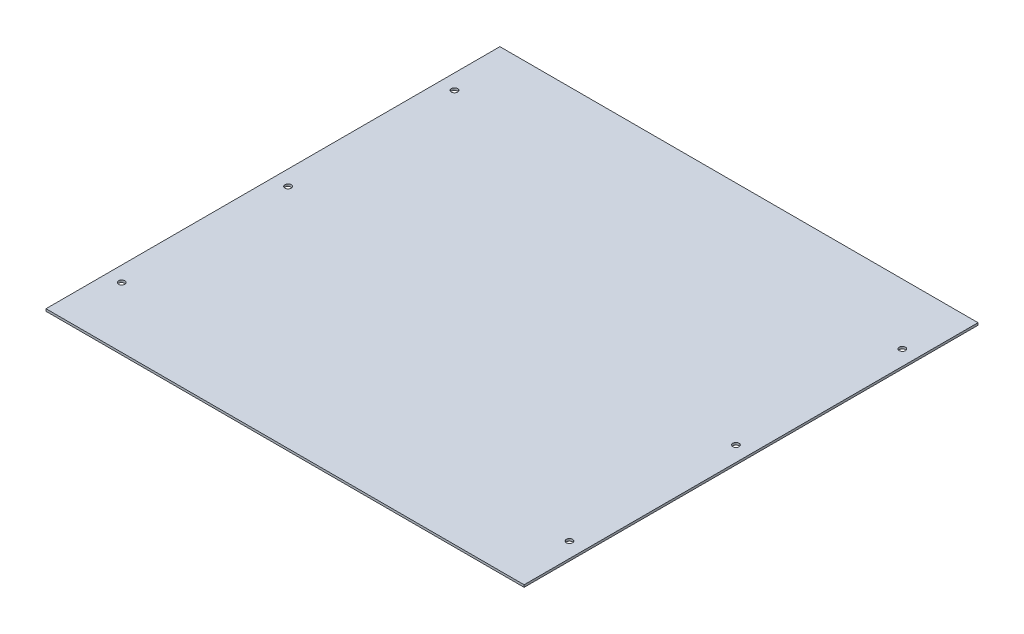
from build123d import *

# Parameters (mm, degrees)
SKETCH1_W                  = 276
SKETCH1_H                  = 300
BOSS_EXTRUDE1_DEPTH        = 1.5
SKETCH3_W                  = 300
SKETCH3_H                  = 1.5
BOSS_EXTRUDE3_DEPTH        = 20
SKETCH4_W                  = 300
SKETCH4_H                  = 1.5
BOSS_EXTRUDE4_DEPTH        = 20
F_4_1_4_1_DIAMETER_HOLE1_D = 4.1


with BuildPart() as part:
    # Sketch1 → Boss-Extrude1 (new body)
    with BuildSketch(Plane(origin=(0, 0, 0), x_dir=(1, 0, 0), z_dir=(0, 1, 0))):
        Rectangle(SKETCH1_W, SKETCH1_H)
    extrude(amount=BOSS_EXTRUDE1_DEPTH)

    # Sketch3 → Boss-Extrude3 (add)
    with BuildSketch(Plane.ZY.offset(138)):
        with Locations((0, 0.75)):
            Rectangle(SKETCH3_W, SKETCH3_H)
    extrude(amount=BOSS_EXTRUDE3_DEPTH)

    # Sketch4 → Boss-Extrude4 (add)
    with BuildSketch(Plane(origin=(138, 0, 0), x_dir=(0, 0, -1), z_dir=(1, 0, 0))):
        with Locations((0, 0.75)):
            Rectangle(SKETCH4_W, SKETCH4_H)
    extrude(amount=BOSS_EXTRUDE4_DEPTH)

    # Ø4.1 (4.1) Diameter Hole1 (through all)
    with Locations(Plane(origin=(0, 0, 0), x_dir=(-1, 0, 0), z_dir=(0, -1, 0))):
        with Locations((-148, 110), (-148, 0), (-148, -110), (148, 0), (148, -110), (148, 110)):
            Hole(F_4_1_4_1_DIAMETER_HOLE1_D / 2)


solid = part.part
